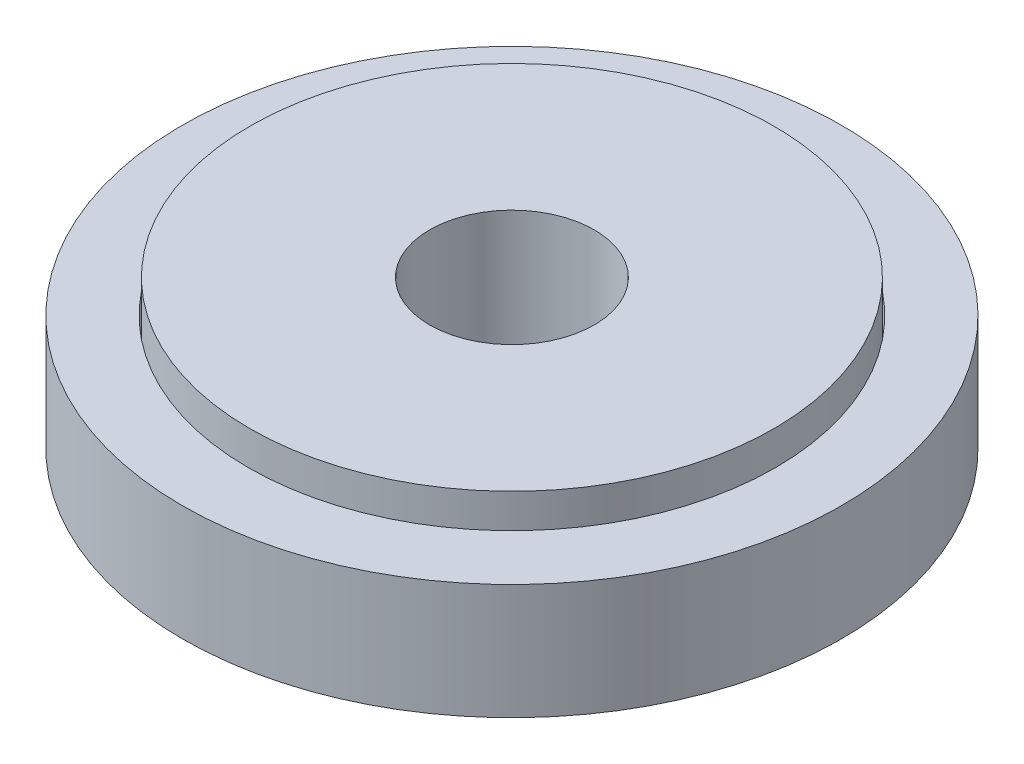
from build123d import *

# Parameters (mm, degrees)
SKETCH1_R                = 10
SKETCH1_R_2              = 8
EXTRUDE_THIN1_DEPTH      = 3.5
BOSS_EXTRUDE1_DEPTH      = 1
BOSS_EXTRUDE1_DEPTH_BACK = 3.5
SKETCH2_R                = 7.95
SKETCH3_R                = 2.5
CUT_EXTRUDE1_DEPTH       = 4.5


with BuildPart() as part:
    # Sketch1 → Extrude-Thin1 (new body)
    with BuildSketch(Plane(origin=(0, 0, 0), x_dir=(1, 0, 0), z_dir=(0, 1, 0))):
        Circle(SKETCH1_R)
        Circle(SKETCH1_R_2, mode=Mode.SUBTRACT)
    extrude(amount=EXTRUDE_THIN1_DEPTH)


with BuildPart() as body_2:
    # Sketch2 → Boss-Extrude1 (new, two sides: drawn at the far end of the back side and taken through both)
    with BuildSketch(Plane(origin=(0, 3.5, 0), x_dir=(1, 0, 0), z_dir=(0, 1, 0)).offset(-BOSS_EXTRUDE1_DEPTH_BACK)):
        with Locations(Location((0, 0, 0), (0, 0, 270))):
            Circle(SKETCH2_R)
    extrude(amount=BOSS_EXTRUDE1_DEPTH + BOSS_EXTRUDE1_DEPTH_BACK)

    # Sketch3 → Cut-Extrude1 (cut)
    with BuildSketch(Plane(origin=(0, 4.5, 0), x_dir=(1, 0, 0), z_dir=(0, 1, 0))):
        with Locations(Location((0, 0, 0), (0, 0, 270))):
            Circle(SKETCH3_R)
    extrude(amount=-CUT_EXTRUDE1_DEPTH, mode=Mode.SUBTRACT)


solid = Compound([part.part, body_2.part])
